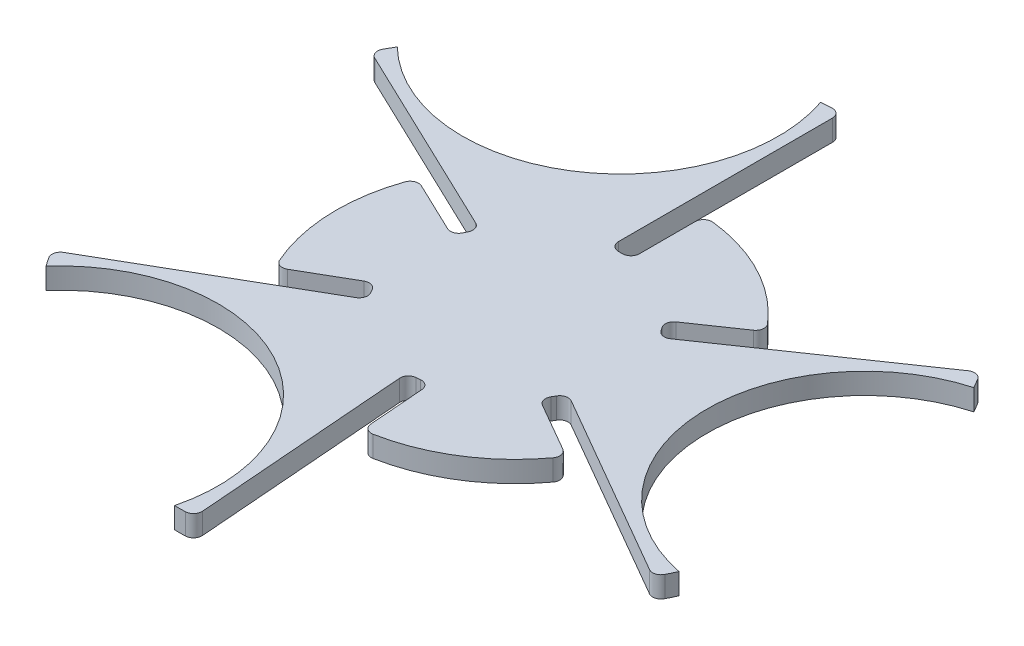
from build123d import *

# Parameters (mm, degrees)
EXTRUDE_1_DEPTH = 5
EXTRUDE_2_DEPTH = 5
FILLET_1_R      = 2


with BuildPart() as part:
    # 草圖1 → 填料-伸長1 (new body)
    with BuildSketch(Plane(origin=(0, 0, 0), x_dir=(1, 0, 0), z_dir=(0, 1, 0))):
        with BuildLine():
            Line((37.992346142, -19.048139926), (22.900635095, -10.334936491))
            Line((22.900635095, -10.334936491), (20.400635095, -14.665063509))
            Line((20.400635095, -14.665063509), (35.492346142, -23.378266945))
            ThreePointArc((35.492346142, -23.378266945), (22.666666667, -35.950969698), (5.793038536, -42.103333651))
            Line((5.793038536, -42.103333651), (4.437329437, -24.729741355))
            Line((4.437329437, -24.729741355), (-0.547516958, -25.118722602))
            Line((-0.547516958, -25.118722602), (0.80819214, -42.492314899))
            ThreePointArc((0.80819214, -42.492314899), (-19.801119716, -37.605394001), (-35.492346142, -23.378266945))
            Line((-35.492346142, -23.378266945), (-20.400635095, -14.665063509))
            Line((-20.400635095, -14.665063509), (-22.900635095, -10.334936491))
            Line((-22.900635095, -10.334936491), (-37.992346142, -19.048139926))
            ThreePointArc((-37.992346142, -19.048139926), (-42.467786382, -1.654424303), (-39.359075794, 16.034748288))
            Line((-39.359075794, 16.034748288), (-23.635248961, 8.522030659))
            Line((-23.635248961, 8.522030659), (-21.479693405, 13.033524896))
            Line((-21.479693405, 13.033524896), (-37.203520238, 20.546242525))
            ThreePointArc((-37.203520238, 20.546242525), (-22.666666667, 35.950969698), (-2.5, 42.426406871))
            Line((-2.5, 42.426406871), (-2.5, 25))
            Line((-2.5, 25), (2.5, 25))
            Line((2.5, 25), (2.5, 42.426406871))
            ThreePointArc((2.5, 42.426406871), (19.801119716, 37.605394001), (33.566037258, 26.068585363))
            Line((33.566037258, 26.068585363), (19.197919523, 16.207710695))
            Line((19.197919523, 16.207710695), (22.027210363, 12.085197706))
            Line((22.027210363, 12.085197706), (36.395328098, 21.946072374))
            ThreePointArc((36.395328098, 21.946072374), (42.467786382, 1.654424303), (37.992346142, -19.048139926))
        make_face()
    extrude(amount=-EXTRUDE_1_DEPTH)

    # 草圖2 → 填料-伸長2 (add)
    with BuildSketch(Plane(origin=(0, 0, 0), x_dir=(1, 0, 0), z_dir=(0, 1, 0))):
        with BuildLine():
            ThreePointArc((-19.801119989, -37.605393858), (-28.547235142, -31.485002236), (-35.492346142, -23.378266945))
            Line((-35.492346142, -23.378266945), (-67.998194922, -42.145527489))
            ThreePointArc((-67.998194922, -42.145527489), (-66.744689536, -44.103814107), (-65.434804053, -46.024845666))
            ThreePointArc((-65.434804053, -46.024845666), (-44.076640505, -33.90903815), (-19.801119989, -37.605393858))
        make_face()
        with BuildLine():
            ThreePointArc((0.80819214, -42.492314899), (-9.805780254, -41.353315147), (-19.801119989, -37.605393858))
            ThreePointArc((-19.801119989, -37.605393858), (-3.016963118, -55.529010522), (-0.920786465, -79.994700776))
            ThreePointArc((-0.920786465, -79.994700776), (1.404318446, -79.987673361), (3.728237111, -79.91307933))
            Line((3.728237111, -79.91307933), (0.80819214, -42.492314899))
        make_face()
        with BuildLine():
            ThreePointArc((42.467786306, 1.654426254), (41.540429584, -8.980128618), (37.992346142, -19.048139926))
            Line((37.992346142, -19.048139926), (70.498194922, -37.81540047))
            ThreePointArc((70.498194922, -37.81540047), (71.567368188, -35.750689653), (72.576087578, -33.655779768))
            ThreePointArc((72.576087578, -33.655779768), (51.404407975, -21.216970456), (42.467786306, 1.654426254))
        make_face()
        with BuildLine():
            ThreePointArc((36.395328098, 21.946072374), (40.71591125, 12.184603853), (42.467786306, 1.654426254))
            ThreePointArc((42.467786306, 1.654426254), (49.598015982, 25.151739473), (69.737836273, 39.199925918))
            ThreePointArc((69.737836273, 39.199925918), (68.569197897, 41.210012129), (67.342638239, 43.185287714))
            Line((67.342638239, 43.185287714), (36.395328098, 21.946072374))
        make_face()
        with BuildLine():
            ThreePointArc((-22.666667398, 35.950969237), (-12.993194762, 40.465131779), (-2.5, 42.426406871))
            Line((-2.5, 42.426406871), (-2.5, 79.960927959))
            ThreePointArc((-2.5, 79.960927959), (-4.822678652, 79.854503759), (-7.141283526, 79.680625434))
            ThreePointArc((-7.141283526, 79.680625434), (-7.3277684, 55.126008913), (-22.666667398, 35.950969237))
        make_face()
        with BuildLine():
            ThreePointArc((-37.203520238, 20.546242525), (-30.910131724, 29.16871195), (-22.666667398, 35.950969237))
            ThreePointArc((-22.666667398, 35.950969237), (-46.581052784, 30.377272025), (-68.817049808, 40.794774859))
            ThreePointArc((-68.817049808, 40.794774859), (-69.973516343, 38.777661232), (-71.07087535, 36.727791616))
            Line((-71.07087535, 36.727791616), (-37.203520238, 20.546242525))
        make_face()
    extrude(amount=-EXTRUDE_2_DEPTH)

    # 圓角1
    fillet_1_edges = [part.edges().sort_by_distance(p)[0] for p in [
        (67.342638239, -2.5, -43.185287714),
        (-2.5, -2.5, -79.960927959),
        (-71.07087535, -2.5, -36.727791616),
        (4.437329437, -2.5, 24.729741355),
        (-0.547516958, -2.5, 25.118722602),
        (-20.400635095, -2.5, 14.665063509),
        (-22.900635095, -2.5, 10.334936491),
        (-37.992346142, -2.5, 19.048139926),
        (-39.359075794, -2.5, -16.034748288),
        (-23.635248961, -2.5, -8.522030659),
        (-21.479693405, -2.5, -13.033524896),
        (-2.5, -2.5, -25),
        (2.5, -2.5, -25),
        (2.5, -2.5, -42.426406871),
        (33.566037258, -2.5, -26.068585363),
        (19.197919523, -2.5, -16.207710695),
        (22.027210363, -2.5, -12.085197706),
        (22.900635095, -2.5, 10.334936491),
        (20.400635095, -2.5, 14.665063509),
        (35.492346142, -2.5, 23.378266945),
        (5.793038536, -2.5, 42.103333651),
        (-67.998194922, -2.5, 42.145527489),
        (3.728237111, -2.5, 79.91307933),
        (70.498194922, -2.5, 37.81540047),
    ]]
    fillet(fillet_1_edges, radius=FILLET_1_R)


solid = part.part
